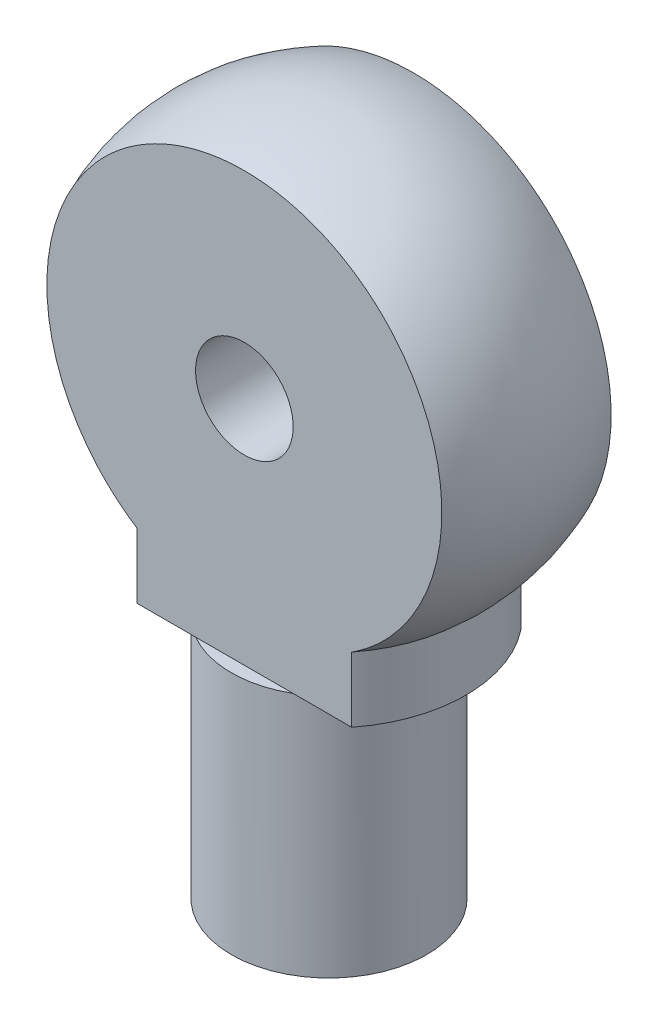
from build123d import *

# Parameters (mm, degrees)
SKETCH1_R               = 7.62
BOSS_EXTRUDE1_DEPTH     = 19.05
CUT_EXTRUDE1_DEPTH      = 59.815433775
CUT_EXTRUDE1_DEPTH_BACK = 59.815433775
SKETCH3_W               = 21.634870399
SKETCH3_H               = 44.538154166
SKETCH3_W_2             = 24.953070172
CUT_EXTRUDE2_DEPTH      = 59.142460648
CUT_EXTRUDE2_DEPTH_BACK = 59.142460648
SKETCH4_R               = 3.81


with BuildPart() as part:
    # Sketch1 → Boss-Extrude1 (new body)
    with BuildSketch(Plane(origin=(0, 0, 0), x_dir=(1, 0, 0), z_dir=(0, 1, 0))):
        with Locations(Location((0, 0, 0), (0, 0, 270))):
            Circle(SKETCH1_R)
    extrude(amount=BOSS_EXTRUDE1_DEPTH)

    # Sketch2 → Revolve1 (revolve)
    with BuildSketch(Plane(origin=(0, 0, 0), x_dir=(0, 0, -1), z_dir=(1, 0, 0)), mode=Mode.PRIVATE) as revolve1_sk:
        with BuildLine():
            Line((-10.668, 19.05), (-10.668, 24.13))
            ThreePointArc((-10.668, 24.13), (-15.776826607, 42.729323061), (0, 53.825568814))
            Line((0, 53.825568814), (0, 19.05))
            Line((0, 19.05), (-10.668, 19.05))
        make_face()
    revolve(revolve1_sk.sketch.rotate(Axis((0, 19.05, 0), (0, 1, 0)), 180), axis=Axis((0, 19.05, 0), (0, 1, 0)))

    # Sketch3 → Cut-Extrude1 (cut, two sides: drawn at the far end of the back side and taken through both)
    with BuildSketch(Plane(origin=(0, 0, 0), x_dir=(0, 0, -1), z_dir=(1, 0, 0)).offset(-CUT_EXTRUDE1_DEPTH_BACK)):
        with Locations((-17.4214352, 41.319077083)):
            Rectangle(SKETCH3_W, SKETCH3_H)
        with Locations((19.080535086, 41.319077083)):
            Rectangle(SKETCH3_W_2, SKETCH3_H)
    extrude(amount=CUT_EXTRUDE1_DEPTH + CUT_EXTRUDE1_DEPTH_BACK, mode=Mode.SUBTRACT)

    # Sketch4 → Cut-Extrude2 (cut, two sides: drawn at the far end of the back side and taken through both)
    with BuildSketch(Plane(origin=(0, 0, -6.604), x_dir=(-1, 0, 0), z_dir=(0, 0, -1)).offset(-CUT_EXTRUDE2_DEPTH_BACK)):
        with Locations((0, 37.061568814)):
            Circle(SKETCH4_R)
    extrude(amount=CUT_EXTRUDE2_DEPTH + CUT_EXTRUDE2_DEPTH_BACK, mode=Mode.SUBTRACT)


solid = part.part
